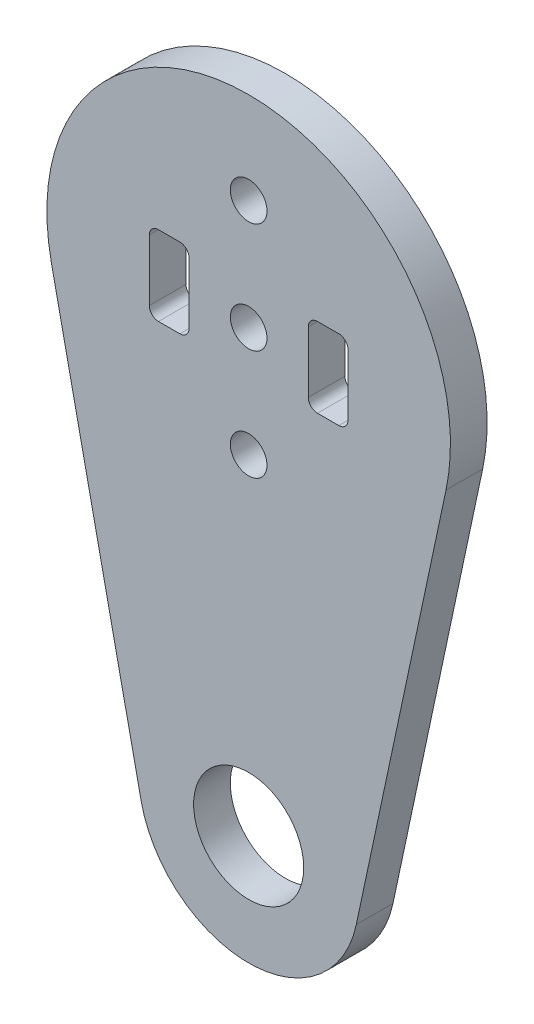
from build123d import *

# Parameters (mm, degrees)
MODEL_R                 = 1.5
MODEL_R_2               = 4.5
SALIENTE_EXTRUIR1_DEPTH = 3


with BuildPart() as part:
    # Model → Saliente-Extruir1 (new body)
    with BuildSketch(Plane.XY):
        with BuildLine():
            Line((206.945286968, 204.077019993), (199.609852846, 238.514519993))
            ThreePointArc((199.609852846, 238.514519993), (215.747807914, 258.452019993), (231.885762981, 238.514519993))
            Line((231.885762981, 238.514519993), (224.550328859, 204.077019993))
            ThreePointArc((224.550328859, 204.077019993), (215.747807914, 196.952019993), (206.945286968, 204.077019993))
        make_face()
        with Locations((215.747807914, 241.952019993)):
            Circle(MODEL_R, mode=Mode.SUBTRACT)
        with Locations((215.747807914, 232.952019993)):
            Circle(MODEL_R, mode=Mode.SUBTRACT)
        with Locations((215.747807914, 250.952019993)):
            Circle(MODEL_R, mode=Mode.SUBTRACT)
        with Locations((215.747807914, 205.952019993)):
            Circle(MODEL_R_2, mode=Mode.SUBTRACT)
        with BuildLine():
            Line((223.122807913, 245.202019993), (221.372807913, 245.202019993))
            ThreePointArc((221.372807913, 245.202019993), (220.842477828, 244.982350079), (220.622807913, 244.452019993))
            Line((220.622807913, 244.452019993), (220.622807913, 239.452019993))
            ThreePointArc((220.622807913, 239.452019993), (220.842477828, 238.921689907), (221.372807913, 238.702019993))
            Line((221.372807913, 238.702019993), (223.122807913, 238.702019993))
            ThreePointArc((223.122807913, 238.702019993), (223.653137999, 238.921689907), (223.872807913, 239.452019993))
            Line((223.872807913, 239.452019993), (223.872807913, 244.452019993))
            ThreePointArc((223.872807913, 244.452019993), (223.653137999, 244.982350079), (223.122807913, 245.202019993))
        make_face(mode=Mode.SUBTRACT)
        with BuildLine():
            Line((208.372807913, 245.202019993), (210.122807913, 245.202019993))
            ThreePointArc((210.122807913, 245.202019993), (210.653137999, 244.982350079), (210.872807913, 244.452019993))
            Line((210.872807913, 244.452019993), (210.872807913, 239.452019993))
            ThreePointArc((210.872807913, 239.452019993), (210.653137999, 238.921689907), (210.122807913, 238.702019993))
            Line((210.122807913, 238.702019993), (208.372807913, 238.702019993))
            ThreePointArc((208.372807913, 238.702019993), (207.842477828, 238.921689907), (207.622807913, 239.452019993))
            Line((207.622807913, 239.452019993), (207.622807913, 244.452019993))
            ThreePointArc((207.622807913, 244.452019993), (207.842477828, 244.982350079), (208.372807913, 245.202019993))
        make_face(mode=Mode.SUBTRACT)
    extrude(amount=SALIENTE_EXTRUIR1_DEPTH)


solid = part.part
